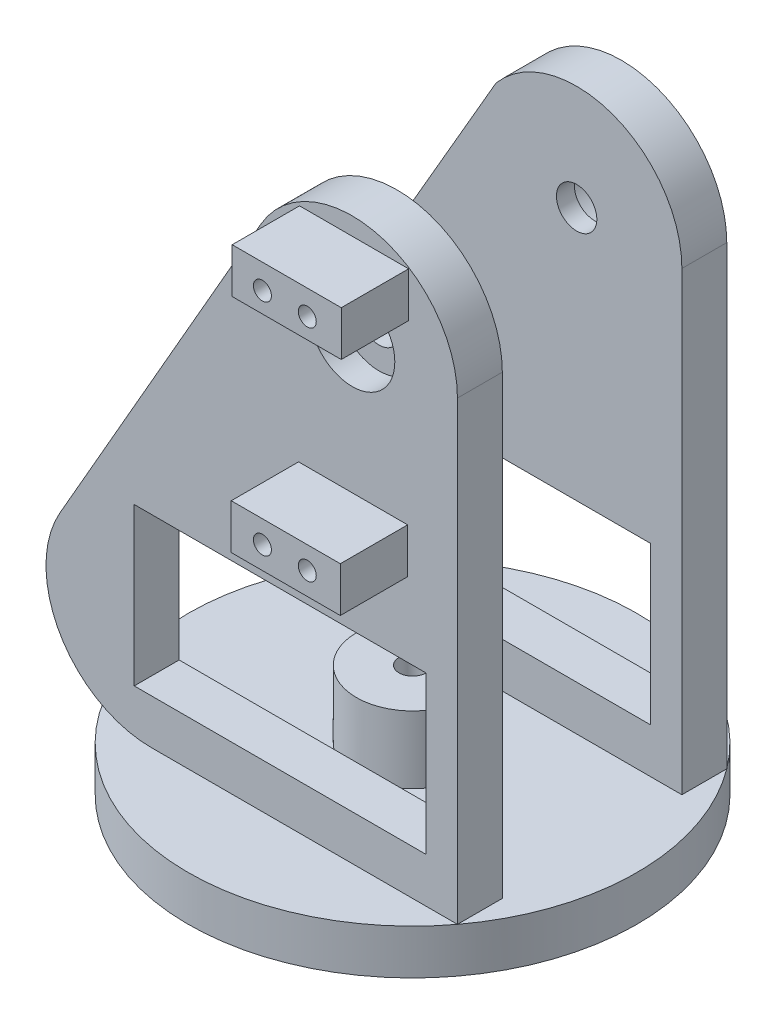
from build123d import *

# Parameters (mm, degrees)
BOSS_EXTRUDE2_DEPTH     = 10
CUT_EXTRUDE2_REACH      = 236.376
SKETCH2_R               = 4.5
SKETCH3_R               = 9.5
CUT_EXTRUDE3_DEPTH      = 6
SKETCH6_W               = 24.299182762
SKETCH6_H               = 10
SKETCH6_W_2             = 24.299182761
BOSS_EXTRUDE7_DEPTH     = 15
CUT_EXTRUDE5_DEPTH      = 15
CUT_EXTRUDE5_DEPTH_BACK = 10
SKETCH5_R               = 2
SKETCH10_W              = 65
SKETCH10_H              = 35
CUT_EXTRUDE6_DEPTH      = 235.64297264
SKETCH11_R              = 4.5
SKETCH11_W              = 65
SKETCH11_H              = 35
BOSS_EXTRUDE8_DEPTH     = 10
SKETCH12_R              = 50
BOSS_EXTRUDE9_DEPTH     = 10
SKETCH13_R              = 3
CUT_EXTRUDE7_DEPTH      = 10
BOSS_EXTRUDE10_START    = 15
SKETCH14_R              = 12.5
SKETCH14_R_2            = 3
BOSS_EXTRUDE10_DEPTH    = 15
CUT_EXTRUDE8_START      = -6
SKETCH15_R              = 9.5
CUT_EXTRUDE8_DEPTH      = 6


with BuildPart() as part:
    # Sketch1 → Boss-Extrude2 (new body)
    with BuildSketch(Plane.XY):
        with BuildLine():
            Line((-99.83076192, 169.92150388), (-144.590341361, 91.840904188))
            ThreePointArc((-144.590341361, 91.840904188), (-144.536211539, 68.422267368), (-124.24600733, 56.7285471))
            Line((-124.24600733, 56.7285471), (-79.486427889, 56.7285471))
            Line((-79.486427889, 56.7285471), (-79.24600733, 56.7285471))
            Line((-79.24600733, 56.7285471), (-56.036427889, 56.7285471))
            Line((-56.036427889, 56.7285471), (-56.036427889, 158.259146792))
            ThreePointArc((-56.036427889, 158.259146792), (-73.452032021, 180.919432901), (-99.83076192, 169.92150388))
        make_face()
    extrude(amount=BOSS_EXTRUDE2_DEPTH)

    # Sketch2 → Cut-Extrude2 (cut, up to next)
    with BuildSketch(Plane.XY.offset(10), mode=Mode.PRIVATE) as cut_extrude2_sk1:
        with Locations((-79.486427889, 158.259146792)):
            Circle(SKETCH2_R)
    cut_extrude2_tool1 = extrude(cut_extrude2_sk1.sketch, amount=-CUT_EXTRUDE2_REACH, mode=Mode.PRIVATE) & part.part
    add(cut_extrude2_tool1.solids().sort_by_distance((-79.486428, 158.259147, 10))[0], mode=Mode.SUBTRACT)

    # Sketch3 → Cut-Extrude3 (cut)
    with BuildSketch(Plane.XY.offset(10)):
        with Locations((-79.486427889, 158.259146792)):
            Circle(SKETCH3_R)
    extrude(amount=-CUT_EXTRUDE3_DEPTH, mode=Mode.SUBTRACT)

    # Sketch6 → Boss-Extrude7 (add)
    with BuildSketch(Plane.XY.offset(10)):
        with Locations((-79.278789724, 123.259146792)):
            Rectangle(SKETCH6_W, SKETCH6_H)
        with Locations((-79.064929675, 172.759146792)):
            Rectangle(SKETCH6_W_2, SKETCH6_H)
    extrude(amount=BOSS_EXTRUDE7_DEPTH)

    # Sketch5 → Cut-Extrude5 (cut, two sides: drawn at the far end of the back side and taken through both)
    with BuildSketch(Plane.XY.offset(10).offset(-CUT_EXTRUDE5_DEPTH_BACK)):
        with Locations((-84.486427889, 172.259146792)):
            Circle(SKETCH5_R)
        with Locations((-74.486427889, 172.259146792)):
            Circle(SKETCH5_R)
        with Locations((-84.486427889, 123.259146792)):
            Circle(SKETCH5_R)
        with Locations((-74.486427889, 123.259146792)):
            Circle(SKETCH5_R)
    extrude(amount=CUT_EXTRUDE5_DEPTH + CUT_EXTRUDE5_DEPTH_BACK, mode=Mode.SUBTRACT)

    # Sketch10 → Cut-Extrude6 (cut, through all)
    with BuildSketch(Plane.XY.offset(10)):
        with Locations((-95.536427889, 84.2285471)):
            Rectangle(SKETCH10_W, SKETCH10_H)
    extrude(amount=-CUT_EXTRUDE6_DEPTH, mode=Mode.SUBTRACT)



with BuildPart() as body_2:
    # Sketch11 → Boss-Extrude8 (new body)
    with BuildSketch(Plane(origin=(0, 0, -40), x_dir=(-1, 0, 0), z_dir=(0, 0, -1))):
        with BuildLine():
            Line((56.036427889, 56.7285471), (56.036427889, 158.259146792))
            ThreePointArc((56.036427889, 158.259146792), (71.460186532, 180.292801725), (97.442137883, 173.342083462))
            Line((97.442137883, 173.342083462), (144.590341361, 91.840904188))
            ThreePointArc((144.590341361, 91.840904188), (144.582356287, 68.395530793), (124.24600733, 56.7285471))
            Line((124.24600733, 56.7285471), (56.036427889, 56.7285471))
        make_face()
        with Locations(Location((79.486427889, 158.259146792, 0), (0, 0, 180))):
            Circle(SKETCH11_R, mode=Mode.SUBTRACT)
        with Locations((95.536427889, 84.2285471)):
            Rectangle(SKETCH11_W, SKETCH11_H, mode=Mode.SUBTRACT)
    extrude(amount=BOSS_EXTRUDE8_DEPTH)


with BuildPart() as part_1:
    add(part.part)

    add(body_2.part)  # Boss-Extrude9 merges body 2
    # Sketch12 → Boss-Extrude9 (add)
    with BuildSketch(Plane.XZ.offset(-56.7285471)):
        with Locations(Location((-96.036427889, -20, 0), (0, 0, 36.869897646))):
            Circle(SKETCH12_R)
    extrude(amount=BOSS_EXTRUDE9_DEPTH)

    # Sketch13 → Cut-Extrude7 (cut)
    with BuildSketch(Plane(origin=(0, 56.7285471, 0), x_dir=(1, 0, 0), z_dir=(0, 1, 0))):
        with Locations(Location((-96.036427889, 20, 0), (0, 0, 270))):
            Circle(SKETCH13_R)
    extrude(amount=-CUT_EXTRUDE7_DEPTH, mode=Mode.SUBTRACT)

    # Sketch14 → Boss-Extrude10 (add)
    with BuildSketch(Plane(origin=(0, 56.7285471, 0), x_dir=(1, 0, 0), z_dir=(0, 1, 0)).offset(BOSS_EXTRUDE10_START)):
        with Locations(Location((-96.036427889, 20, 0), (0, 0, 90))):
            Circle(SKETCH14_R)
        with Locations(Location((-96.036427889, 20, 0), (0, 0, 270))):
            Circle(SKETCH14_R_2, mode=Mode.SUBTRACT)
    extrude(amount=-BOSS_EXTRUDE10_DEPTH)

    # Sketch15 → Cut-Extrude8 (cut)
    with BuildSketch(Plane(origin=(0, 0, -50), x_dir=(-1, 0, 0), z_dir=(0, 0, -1)).offset(CUT_EXTRUDE8_START)):
        with Locations(Location((79.486427889, 158.259146792, 0), (0, 0, 180))):
            Circle(SKETCH15_R)
    extrude(amount=CUT_EXTRUDE8_DEPTH, mode=Mode.SUBTRACT)


solid = part_1.part
